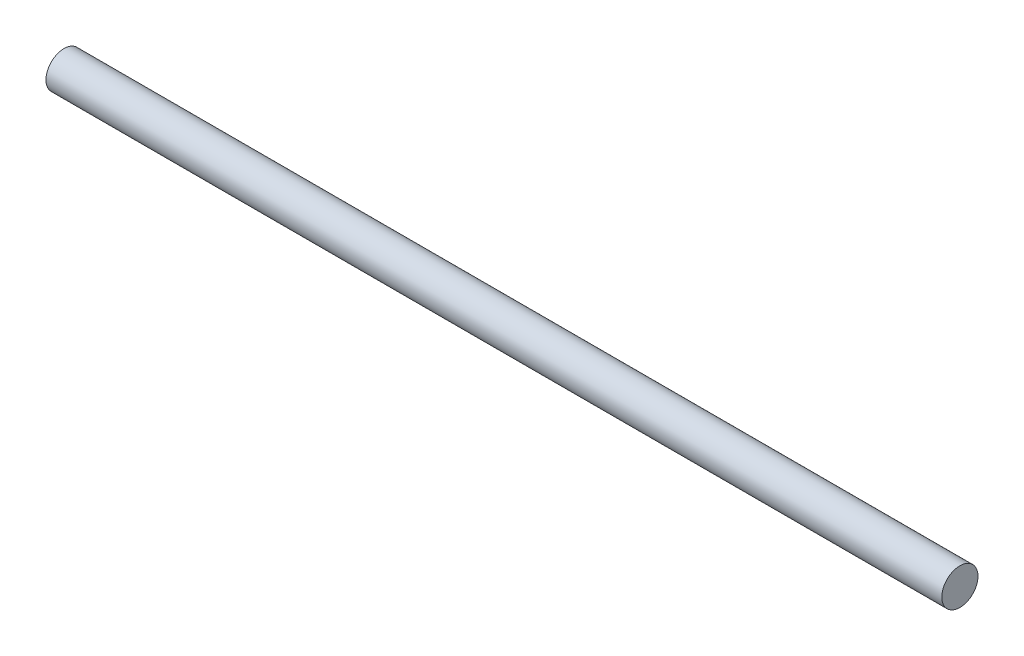
from build123d import *

# Parameters (mm, degrees)
SKETCH1_R           = 6.35
BOSS_EXTRUDE1_DEPTH = 314.325


with BuildPart() as part:
    # Sketch1 → Boss-Extrude1 (new body)
    with BuildSketch(Plane(origin=(0, 0, 0), x_dir=(0, 0, -1), z_dir=(1, 0, 0))):
        Circle(SKETCH1_R)
    extrude(amount=BOSS_EXTRUDE1_DEPTH)


solid = part.part
